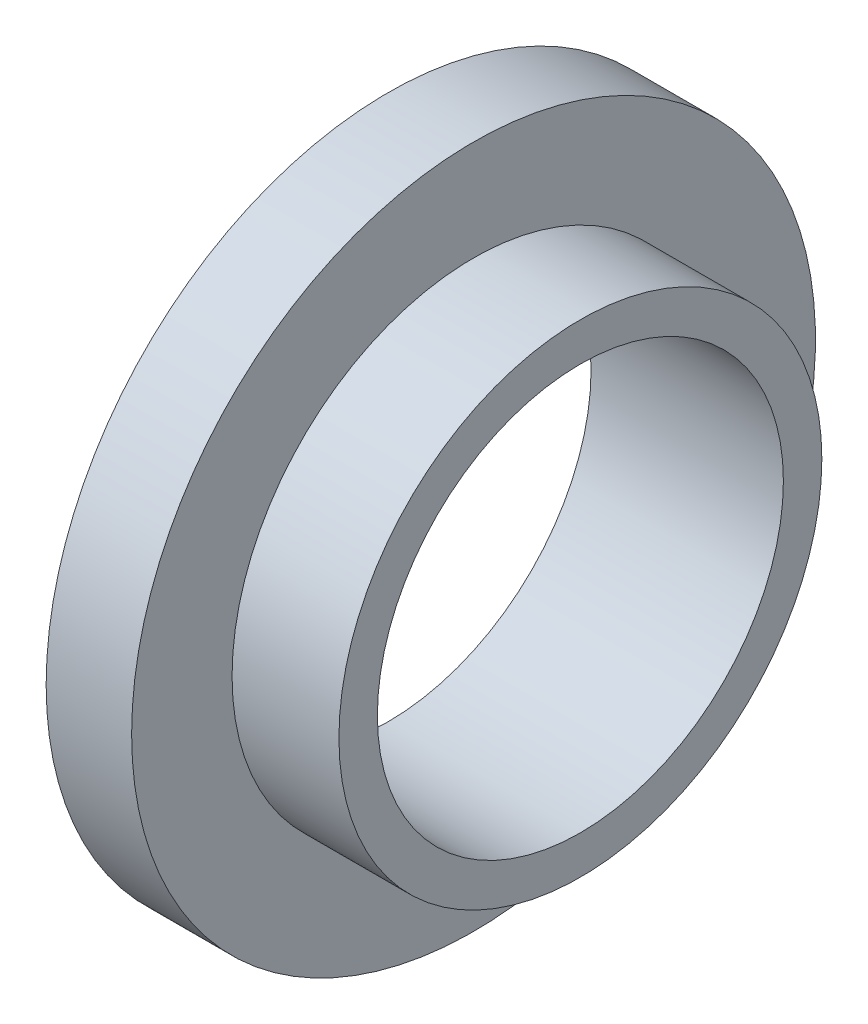
from build123d import *

# Parameters (mm, degrees)
SKETCH_1_R          = 80
EXTRUDE_1_DEPTH     = 45
SKETCH_2_R          = 47.5
CUT_EXTRUDE_1_DEPTH = 122.757956619
SKETCH_3_OUTSIDE_W  = 208.142
SKETCH_3_OUTSIDE_H  = 208.142
SKETCH_3_OUTSIDE_R  = 56.5
CUT_EXTRUDE_2_DEPTH = 25


with BuildPart() as part:
    # 草图1 → 凸台-拉伸1 (new body)
    with BuildSketch(Plane(origin=(0, 0, 0), x_dir=(0, 0, -1), z_dir=(1, 0, 0))):
        with Locations(Location((0, 0, 0), (0, 0, 180))):
            Circle(SKETCH_1_R)
    extrude(amount=EXTRUDE_1_DEPTH)

    # 草图2 → 切除-拉伸1 (cut, through all)
    with BuildSketch(Plane(origin=(45, 0, 0), x_dir=(0, 0, -1), z_dir=(1, 0, 0))):
        Circle(SKETCH_2_R)
    extrude(amount=-CUT_EXTRUDE_1_DEPTH, mode=Mode.SUBTRACT)

    # 草图3 outside → 切除-拉伸2 (cut)
    with BuildSketch(Plane(origin=(45, 0, 0), x_dir=(0, 0, -1), z_dir=(1, 0, 0))):
        Rectangle(SKETCH_3_OUTSIDE_W, SKETCH_3_OUTSIDE_H)
        Circle(SKETCH_3_OUTSIDE_R, mode=Mode.SUBTRACT)
    extrude(amount=-CUT_EXTRUDE_2_DEPTH, mode=Mode.SUBTRACT)


solid = part.part
